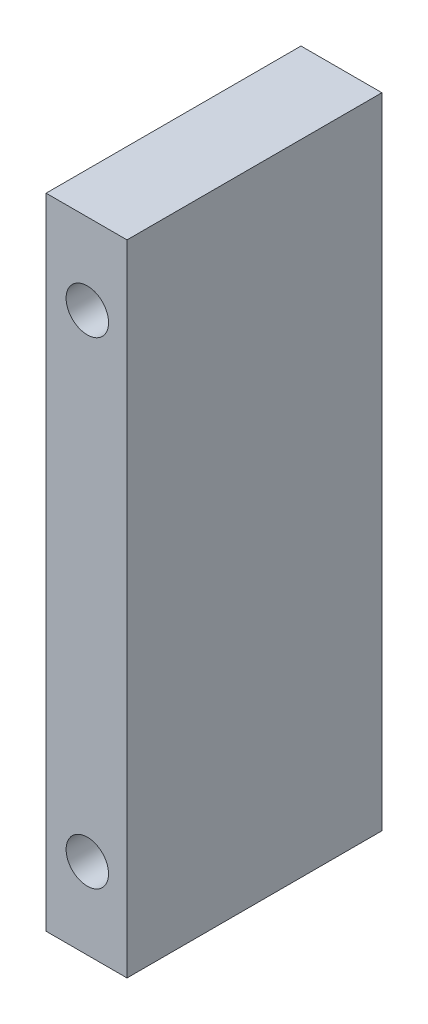
from build123d import *

# Parameters (mm, degrees)
SKETCH1_W           = 63.2
SKETCH1_H           = 8
SKETCH1_R           = 2.1
BOSS_EXTRUDE1_DEPTH = 25.2


with BuildPart() as part:
    # Sketch1 → Boss-Extrude1 (new body)
    with BuildSketch(Plane(origin=(0, 0, 0), x_dir=(0, 1, 0), z_dir=(0, 0, 1))):
        with Locations((31.6, 4)):
            Rectangle(SKETCH1_W, SKETCH1_H)
        with Locations(Location((8, 3.924284309, 0), (0, 0, 270))):
            Circle(SKETCH1_R, mode=Mode.SUBTRACT)
        with Locations(Location((55.2, 3.924284309, 0), (0, 0, 270))):
            Circle(SKETCH1_R, mode=Mode.SUBTRACT)
    extrude(amount=BOSS_EXTRUDE1_DEPTH)


solid = part.part
